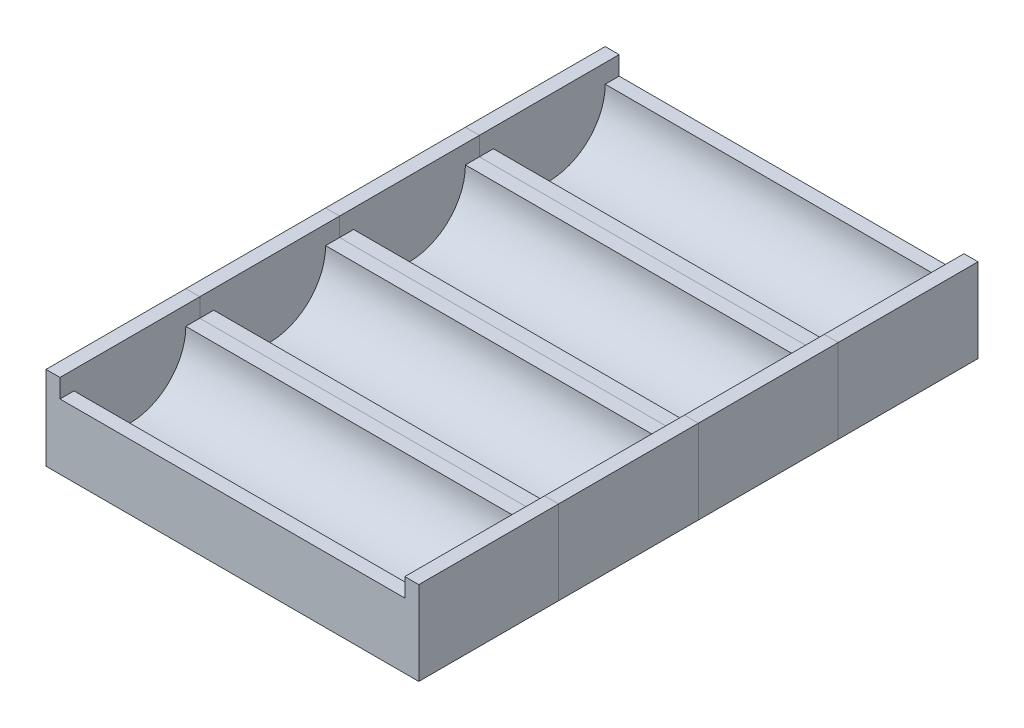
from build123d import *

# Parameters (mm, degrees)
BOSS_EXTRUDE1_DEPTH = 1.5
BOSS_EXTRUDE2_DEPTH = 74
LPATTERN1_COUNT     = 4
LPATTERN1_PITCH     = 30


with BuildPart() as part:
    # Sketch1 → Boss-Extrude1 (new, symmetric)
    with BuildSketch(Plane(origin=(0, 0, 0), x_dir=(0, 0, -1), z_dir=(1, 0, 0))):
        Polygon((-15, 3), (15, 3), (15, -12.5), (15, -15), (-15, -15), (-15, -12.5), align=None)
    boss_extrude1 = extrude(amount=BOSS_EXTRUDE1_DEPTH, both=True)

    # Sketch2 → Boss-Extrude2 (add)
    with BuildSketch(Plane(origin=(1.5, 0, 0), x_dir=(0, 0, -1), z_dir=(1, 0, 0))):
        with BuildLine():
            ThreePointArc((12, -1), (0, -13), (-12, -1))
            Line((-12, -1), (-15, -1))
            Line((-15, -1), (-15, -15))
            Line((-15, -15), (15, -15))
            Line((15, -15), (15, -1))
            Line((15, -1), (12, -1))
        make_face()
    extrude(amount=BOSS_EXTRUDE2_DEPTH)

    # Mirror1: Boss-Extrude1 across plane
    add(boss_extrude1.mirror(Plane(origin=(38.5, 0, 0), x_dir=(0, 0, 1), z_dir=(1, 0, 0))))


with BuildPart() as lpattern1_1:
    # LPattern1: pattern copy
    add(part.part.moved(Location(Vector(0, 0, 1) * (1 * LPATTERN1_PITCH))))


with BuildPart() as lpattern1_2:
    # LPattern1: pattern copy
    add(part.part.moved(Location(Vector(0, 0, 1) * (2 * LPATTERN1_PITCH))))


with BuildPart() as lpattern1_3:
    # LPattern1: pattern copy
    add(part.part.moved(Location(Vector(0, 0, 1) * (3 * LPATTERN1_PITCH))))


solid = Compound([part.part, lpattern1_1.part, lpattern1_2.part, lpattern1_3.part])
